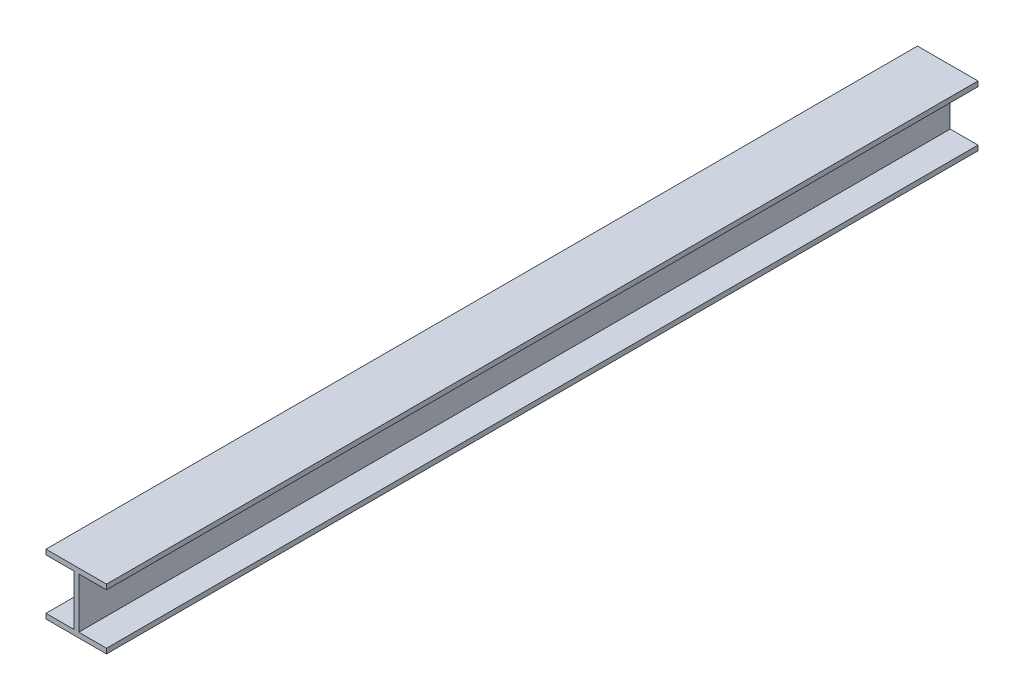
from build123d import *

# Parameters (mm, degrees)
BOSS_EXTRUDE1_DEPTH = 914.4


with BuildPart() as part:
    # Sketch1 → Boss-Extrude1 (new, symmetric)
    with BuildSketch(Plane.XY):
        Polygon((-63.5, 63.5), (-63.5, 53.0352), (-5.2451, 53.0352), (-5.2451, -53.0352), (-63.5, -53.0352), (-63.5, -63.5), (63.5, -63.5), (63.5, -53.0352), (5.2451, -53.0352), (5.2451, 53.0352), (63.5, 53.0352), (63.5, 63.5), align=None)
    extrude(amount=BOSS_EXTRUDE1_DEPTH, both=True)


solid = part.part
